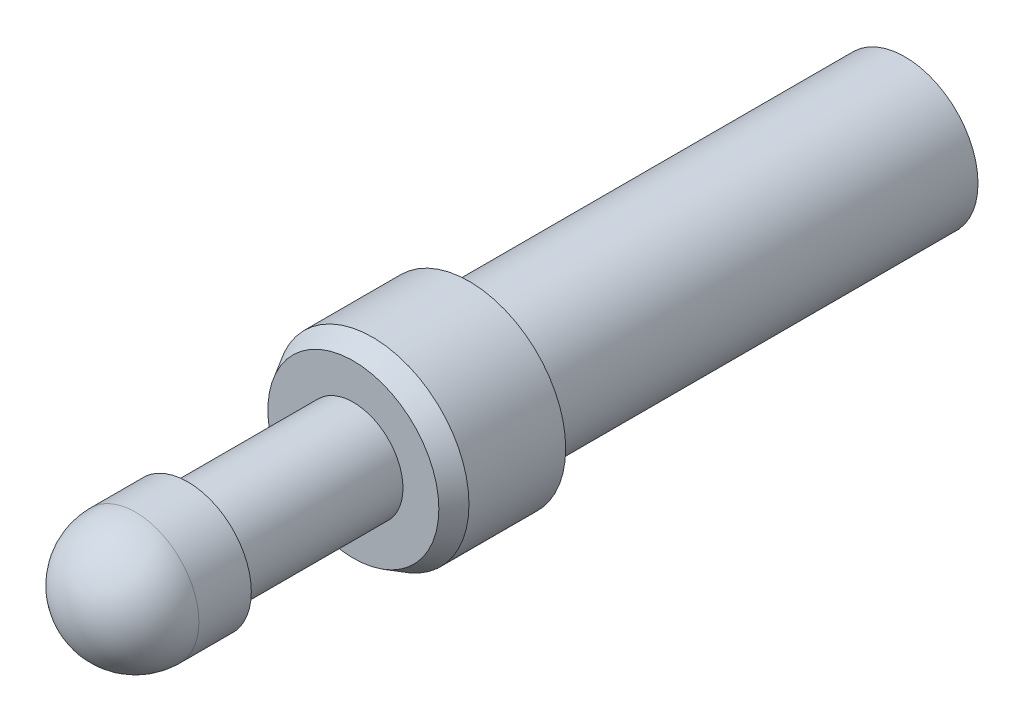
from build123d import *

# Parameters (mm, degrees)
ESQUISSE1_R      = 1.325
EXTRUSION1_DEPTH = 7.9
ESQUISSE2_R      = 1.75
EXTRUSION2_DEPTH = 2.1
ESQUISSE3_R      = 0.9
EXTRUSION3_DEPTH = 3
ESQUISSE4_R      = 1.15
EXTRUSION4_DEPTH = 2.1
CONG_1_R         = 1.15
CHANFREIN1_SIZE  = 0.2
CHANFREIN1_SIZE2 = 0.346410162


with BuildPart() as part:
    # Esquisse1 → Extrusion1 (new body)
    with BuildSketch(Plane.XY):
        Circle(ESQUISSE1_R)
    extrude(amount=EXTRUSION1_DEPTH)

    # Esquisse2 → Extrusion2 (add)
    with BuildSketch(Plane.XY.offset(7.9)):
        Circle(ESQUISSE2_R)
    extrude(amount=EXTRUSION2_DEPTH)

    # Esquisse3 → Extrusion3 (add)
    with BuildSketch(Plane.XY.offset(10)):
        Circle(ESQUISSE3_R)
    extrude(amount=EXTRUSION3_DEPTH)

    # Esquisse4 → Extrusion4 (add)
    with BuildSketch(Plane.XY.offset(13)):
        Circle(ESQUISSE4_R)
    extrude(amount=EXTRUSION4_DEPTH)

    # Congé1
    cong_1_edges = [part.edges().sort_by_distance(p)[0] for p in [
        (-1.15, 0, 15.1),
    ]]
    fillet(cong_1_edges, radius=CONG_1_R)

    # Chanfrein1
    chanfrein1_edges = [part.edges().sort_by_distance(p)[0] for p in [
        (-1.75, 0, 10),
    ]]
    chanfrein1_side = [part.faces().sort_by_distance(p)[0] for p in [
        (-1.700502525, 0, 10),
    ]]
    chamfer(chanfrein1_edges, length=CHANFREIN1_SIZE, length2=CHANFREIN1_SIZE2, reference=chanfrein1_side[0])


solid = part.part
